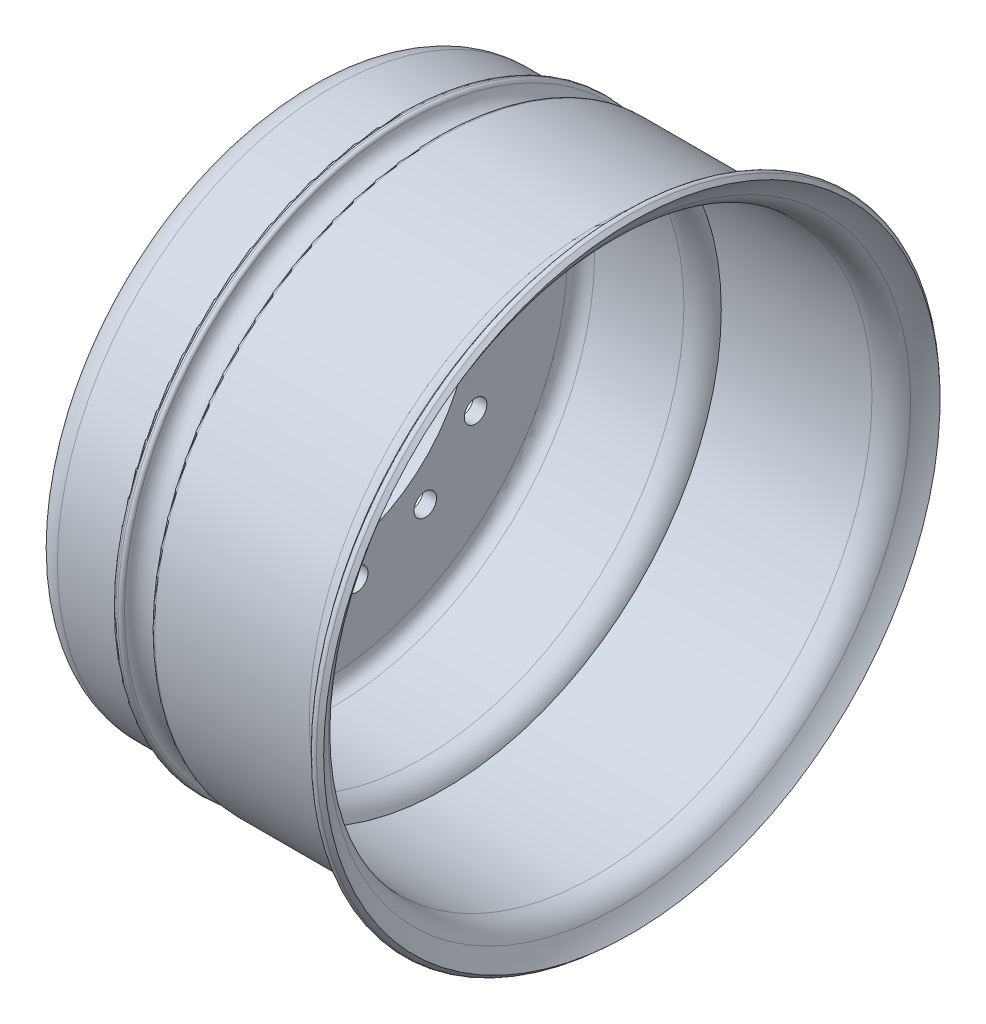
from build123d import *

# Parameters (mm, degrees)
SKETCH2_R          = 7.5
CUT_EXTRUDE1_DEPTH = 367.451670999
CIRPATTERN1_COUNT  = 15
FILLET2_R          = 2.5


with BuildPart() as part:
    # Sketch1 → Revolve1 (revolve)
    with BuildSketch(Plane.XY, mode=Mode.PRIVATE) as revolve1_sk:
        with BuildLine():
            Line((16, 174), (-43.407676812, 174))
            ThreePointArc((-43.407676812, 174), (-49.771637843, 171.363961031), (-52.407676812, 165))
            Line((-52.407676812, 165), (-52.407676812, 100))
            Line((-52.407676812, 100), (-61.407676812, 100))
            Line((-61.407676812, 100), (-61.407676812, 165))
            ThreePointArc((-61.407676812, 165), (-56.135598874, 177.727922061), (-43.407676812, 183))
            Line((-43.407676812, 183), (1.61250543, 183))
            ThreePointArc((1.61250543, 183), (1.381500916, 183.496194611), (1.167603026, 184))
            Line((1.167603026, 184), (0, 184))
            Line((0, 184), (0, 190))
            Line((0, 190), (6, 190))
            ThreePointArc((6, 190), (16, 180), (26, 190))
            Line((26, 190), (131, 190))
            ThreePointArc((131, 190), (137.326426611, 191.719168569), (141.912662216, 196.403787786))
            ThreePointArc((141.912662216, 196.403787786), (146.083516094, 202.924819463), (151, 208.903787786))
            Line((151, 208.903787786), (155.399246684, 204.823759769))
            ThreePointArc((155.399246684, 204.823759769), (150.936592061, 199.396696214), (147.150740079, 193.477605923))
            ThreePointArc((147.150740079, 193.477605923), (140.363111384, 186.544369482), (131, 184))
            Line((131, 184), (30.832396974, 184))
            ThreePointArc((30.832396974, 184), (24.94427191, 176.733500839), (16, 174))
        make_face()
    revolve(revolve1_sk.sketch.rotate(Axis((0, 0, 0), (1, 0, 0)), 90), axis=Axis((0, 0, 0), (1, 0, 0)))

    # Sketch2 → Cut-Extrude1 (cut, through all)
    with BuildSketch(Plane.ZY.offset(61.407676812)):
        with Locations((0, 120)):
            Circle(SKETCH2_R)
    cut_extrude1 = extrude(amount=-CUT_EXTRUDE1_DEPTH, mode=Mode.SUBTRACT)

    # CirPattern1: Cut-Extrude1 ×15 about axis
    cirpattern1_axis = Axis((0, 0, 0), (1, 0, 0))
    for i in range(1, CIRPATTERN1_COUNT):
        add(cut_extrude1.rotate(cirpattern1_axis, i * 360 / CIRPATTERN1_COUNT), mode=Mode.SUBTRACT)

    # Fillet2
    fillet2_edges = [part.edges().sort_by_distance(p)[0] for p in [
        (0, 0, -190),
        (6, 0, -190),
        (26, 0, -190),
        (151, 0, -208.903787786),
    ]]
    fillet(fillet2_edges, radius=FILLET2_R)


solid = part.part
